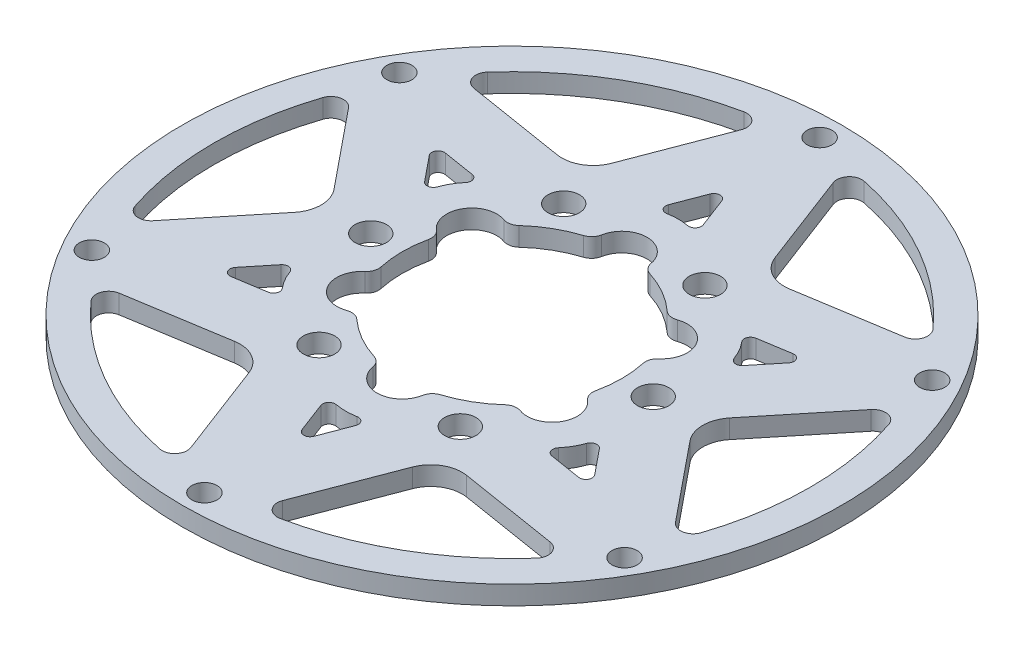
from build123d import *

# Parameters (mm, degrees)
SKETCH_1_R          = 52.5
SKETCH_1_R_2        = 2
SKETCH_1_R_3        = 2.5
EXTRUDE_1_DEPTH     = 3
CUT_EXTRUDE_1_DEPTH = 75.306796459
FILLET_1_R          = 5
FILLET_2_R          = 1
FILLET_3_R          = 2


with BuildPart() as part:
    # 草图1 → 凸台-拉伸1 (new body)
    with BuildSketch(Plane(origin=(0, 0, 0), x_dir=(1, 0, 0), z_dir=(0, 1, 0))):
        with Locations(Location((0, 0, 0), (0, 0, 270))):
            Circle(SKETCH_1_R)
        with Locations(Location((0, 49, 0), (0, 0, 270))):
            Circle(SKETCH_1_R_2, mode=Mode.SUBTRACT)
        with Locations(Location((-11.25, 19.485571585, 0), (0, 0, 270))):
            Circle(SKETCH_1_R_3, mode=Mode.SUBTRACT)
        with Locations(Location((42.435244785, 24.5, 0), (0, 0, 270))):
            Circle(SKETCH_1_R_2, mode=Mode.SUBTRACT)
        with Locations(Location((11.25, 19.485571585, 0), (0, 0, 270))):
            Circle(SKETCH_1_R_3, mode=Mode.SUBTRACT)
        with Locations(Location((42.435244785, -24.5, 0), (0, 0, 270))):
            Circle(SKETCH_1_R_2, mode=Mode.SUBTRACT)
        with Locations(Location((22.5, 0, 0), (0, 0, 270))):
            Circle(SKETCH_1_R_3, mode=Mode.SUBTRACT)
        with Locations(Location((0, -49, 0), (0, 0, 270))):
            Circle(SKETCH_1_R_2, mode=Mode.SUBTRACT)
        with Locations(Location((11.25, -19.485571585, 0), (0, 0, 270))):
            Circle(SKETCH_1_R_3, mode=Mode.SUBTRACT)
        with Locations(Location((-42.435244785, -24.5, 0), (0, 0, 270))):
            Circle(SKETCH_1_R_2, mode=Mode.SUBTRACT)
        with Locations(Location((-11.25, -19.485571585, 0), (0, 0, 270))):
            Circle(SKETCH_1_R_3, mode=Mode.SUBTRACT)
        with Locations(Location((-42.435244785, 24.5, 0), (0, 0, 270))):
            Circle(SKETCH_1_R_2, mode=Mode.SUBTRACT)
        with Locations(Location((-22.5, 0, 0), (0, 0, 270))):
            Circle(SKETCH_1_R_3, mode=Mode.SUBTRACT)
        with BuildLine():
            ThreePointArc((11.796996923, 12.925976311), (8.75, 15.155444566), (5.295725392, 16.679487179))
            ThreePointArc((5.295725392, 16.679487179), (4.40085173, 17.262951372), (3.933967434, 18.223809524))
            ThreePointArc((3.933967434, 18.223809524), (0, 21.5), (-3.933967434, 18.223809524))
            ThreePointArc((-3.933967434, 18.223809524), (-4.40085173, 17.262951372), (-5.295725392, 16.679487179))
            ThreePointArc((-5.295725392, 16.679487179), (-8.75, 15.155444566), (-11.796996923, 12.925976311))
            ThreePointArc((-11.796996923, 12.925976311), (-12.749728567, 12.442725082), (-13.815298284, 12.518820498))
            ThreePointArc((-13.815298284, 12.518820498), (-18.619546181, 10.75), (-17.749265718, 5.704989026))
            ThreePointArc((-17.749265718, 5.704989026), (-17.150580297, 4.820226289), (-17.092722316, 3.753510869))
            ThreePointArc((-17.092722316, 3.753510869), (-17.5, 0), (-17.092722316, -3.753510869))
            ThreePointArc((-17.092722316, -3.753510869), (-17.150580297, -4.820226289), (-17.749265718, -5.704989026))
            ThreePointArc((-17.749265718, -5.704989026), (-18.619546181, -10.75), (-13.815298284, -12.518820498))
            ThreePointArc((-13.815298284, -12.518820498), (-12.749728567, -12.442725082), (-11.796996923, -12.925976311))
            ThreePointArc((-11.796996923, -12.925976311), (-8.75, -15.155444566), (-5.295725392, -16.679487179))
            ThreePointArc((-5.295725392, -16.679487179), (-4.40085173, -17.262951372), (-3.933967434, -18.223809524))
            ThreePointArc((-3.933967434, -18.223809524), (0, -21.5), (3.933967434, -18.223809524))
            ThreePointArc((3.933967434, -18.223809524), (4.40085173, -17.262951372), (5.295725392, -16.679487179))
            ThreePointArc((5.295725392, -16.679487179), (8.75, -15.155444566), (11.796996923, -12.925976311))
            ThreePointArc((11.796996923, -12.925976311), (12.749728567, -12.442725082), (13.815298284, -12.518820498))
            ThreePointArc((13.815298284, -12.518820498), (18.619546181, -10.75), (17.749265718, -5.704989026))
            ThreePointArc((17.749265718, -5.704989026), (17.150580297, -4.820226289), (17.092722316, -3.753510869))
            ThreePointArc((17.092722316, -3.753510869), (17.5, 0), (17.092722316, 3.753510869))
            ThreePointArc((17.092722316, 3.753510869), (17.150580297, 4.820226289), (17.749265718, 5.704989026))
            ThreePointArc((17.749265718, 5.704989026), (18.619546181, 10.75), (13.815298284, 12.518820498))
            ThreePointArc((13.815298284, 12.518820498), (12.749728567, 12.442725082), (11.796996923, 12.925976311))
        make_face(mode=Mode.SUBTRACT)
    extrude(amount=EXTRUDE_1_DEPTH)

    # 草图2 → 切除-拉伸1 (cut, through all)
    with BuildSketch(Plane(origin=(0, 3, 0), x_dir=(1, 0, 0), z_dir=(0, 1, 0))):
        with BuildLine():
            Line((-6.071164737, 47.110412424), (-14.473042792, 25.068045456))
            Line((-14.473042792, 25.068045456), (-37.763231573, 28.812989105))
            ThreePointArc((-37.763231573, 28.812989105), (-23.75, 41.13620668), (-6.071164737, 47.110412424))
        make_face()
        with BuildLine():
            Line((0, 34.961858062), (3.494563236, 25.793854821))
            ThreePointArc((3.494563236, 25.793854821), (0, 26.5), (-3.494563236, 25.793854821))
            Line((-3.494563236, 25.793854821), (0, 34.961858062))
        make_face()
        with BuildLine():
            Line((14.473042792, 25.068045456), (6.071164737, 47.110412424))
            ThreePointArc((6.071164737, 47.110412424), (23.75, 41.13620668), (37.763231573, 28.812989105))
            Line((37.763231573, 28.812989105), (14.473042792, 25.068045456))
        make_face()
        with BuildLine():
            Line((30.277857245, 17.480929031), (20.590851919, 15.923307948))
            ThreePointArc((20.590851919, 15.923307948), (22.9496732, 13.25), (24.085415154, 9.870546873))
            Line((24.085415154, 9.870546873), (30.277857245, 17.480929031))
        make_face()
        with BuildLine():
            Line((28.946085584, 0), (43.83439631, 18.297423319))
            ThreePointArc((43.83439631, 18.297423319), (47.5, 0), (43.83439631, -18.297423319))
            Line((43.83439631, -18.297423319), (28.946085584, 0))
        make_face()
        with BuildLine():
            Line((30.277857245, -17.480929031), (24.085415154, -9.870546873))
            ThreePointArc((24.085415154, -9.870546873), (22.9496732, -13.25), (20.590851919, -15.923307948))
            Line((20.590851919, -15.923307948), (30.277857245, -17.480929031))
        make_face()
        with BuildLine():
            Line((14.473042792, -25.068045456), (37.763231573, -28.812989105))
            ThreePointArc((37.763231573, -28.812989105), (23.75, -41.13620668), (6.071164737, -47.110412424))
            Line((6.071164737, -47.110412424), (14.473042792, -25.068045456))
        make_face()
        with BuildLine():
            Line((0, -34.961858062), (3.494563236, -25.793854821))
            ThreePointArc((3.494563236, -25.793854821), (0, -26.5), (-3.494563236, -25.793854821))
            Line((-3.494563236, -25.793854821), (0, -34.961858062))
        make_face()
        with BuildLine():
            Line((-14.473042792, -25.068045456), (-6.071164737, -47.110412424))
            ThreePointArc((-6.071164737, -47.110412424), (-23.75, -41.13620668), (-37.763231573, -28.812989105))
            Line((-37.763231573, -28.812989105), (-14.473042792, -25.068045456))
        make_face()
        with BuildLine():
            Line((-30.277857245, -17.480929031), (-20.590851919, -15.923307948))
            ThreePointArc((-20.590851919, -15.923307948), (-22.9496732, -13.25), (-24.085415154, -9.870546873))
            Line((-24.085415154, -9.870546873), (-30.277857245, -17.480929031))
        make_face()
        with BuildLine():
            Line((-28.946085584, 0), (-43.83439631, -18.297423319))
            ThreePointArc((-43.83439631, -18.297423319), (-47.5, 0), (-43.83439631, 18.297423319))
            Line((-43.83439631, 18.297423319), (-28.946085584, 0))
        make_face()
        with BuildLine():
            Line((-30.277857245, 17.480929031), (-24.085415154, 9.870546873))
            ThreePointArc((-24.085415154, 9.870546873), (-22.9496732, 13.25), (-20.590851919, 15.923307948))
            Line((-20.590851919, 15.923307948), (-30.277857245, 17.480929031))
        make_face()
    extrude(amount=-CUT_EXTRUDE_1_DEPTH, mode=Mode.SUBTRACT)

    # 圆角1
    fillet_1_edges = [part.edges().sort_by_distance(p)[0] for p in [
        (-14.473042792, 1.5, 25.068045456),
        (14.473042792, 1.5, 25.068045456),
        (28.946085584, 1.5, 0),
        (14.473042792, 1.5, -25.068045456),
        (-28.946085584, 1.5, 0),
        (-14.473042792, 1.5, -25.068045456),
    ]]
    fillet(fillet_1_edges, radius=FILLET_1_R)

    # 圆角2
    fillet_2_edges = [part.edges().sort_by_distance(p)[0] for p in [
        (0, 1.5, 34.961858062),
        (-3.494563236, 1.5, 25.793854821),
        (3.494563236, 1.5, 25.793854821),
        (30.277857245, 1.5, 17.480929031),
        (20.590851919, 1.5, 15.923307948),
        (24.085415154, 1.5, 9.870546873),
        (30.277857245, 1.5, -17.480929031),
        (24.085415154, 1.5, -9.870546873),
        (20.590851919, 1.5, -15.923307948),
        (-3.494563236, 1.5, -25.793854821),
        (0, 1.5, -34.961858062),
        (3.494563236, 1.5, -25.793854821),
        (-30.277857245, 1.5, -17.480929031),
        (-20.590851919, 1.5, -15.923307948),
        (-24.085415154, 1.5, -9.870546873),
        (-30.277857245, 1.5, 17.480929031),
        (-24.085415154, 1.5, 9.870546873),
        (-20.590851919, 1.5, 15.923307948),
    ]]
    fillet(fillet_2_edges, radius=FILLET_2_R)

    # 圆角3
    fillet_3_edges = [part.edges().sort_by_distance(p)[0] for p in [
        (-6.071164737, 1.5, 47.110412424),
        (-37.763231573, 1.5, 28.812989105),
        (37.763231573, 1.5, 28.812989105),
        (6.071164737, 1.5, 47.110412424),
        (43.83439631, 1.5, -18.297423319),
        (43.83439631, 1.5, 18.297423319),
        (6.071164737, 1.5, -47.110412424),
        (37.763231573, 1.5, -28.812989105),
        (-43.83439631, 1.5, 18.297423319),
        (-43.83439631, 1.5, -18.297423319),
        (-37.763231573, 1.5, -28.812989105),
        (-6.071164737, 1.5, -47.110412424),
    ]]
    fillet(fillet_3_edges, radius=FILLET_3_R)


solid = part.part
